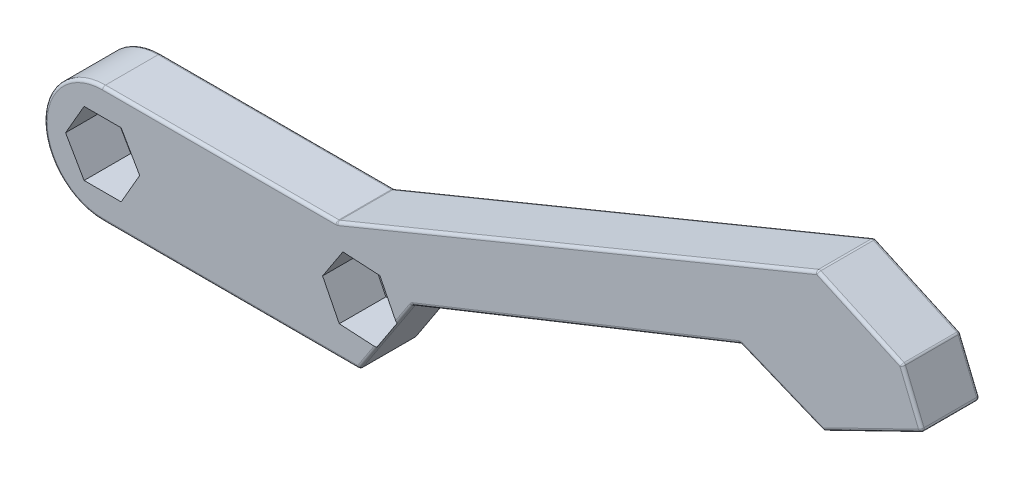
from build123d import *

# Parameters (mm, degrees)
SKETCH1_R           = 1.65
BOSS_EXTRUDE1_DEPTH = 5
FILLET2_R           = 0.25
CUT_EXTRUDE1_DEPTH  = 4


with BuildPart() as part:
    # Sketch1 → Boss-Extrude1 (new body)
    # profile 1 of 2: a face of its own
    with BuildSketch(Plane.XY):
        with BuildLine():
            Line((-5.168635154, -1.464478016), (-25.218635154, -1.464478016))
            ThreePointArc((-25.218635154, -1.464478016), (-30.218635154, -6.464478016), (-25.218635154, -11.464478016))
            Line((-25.218635154, -11.464478016), (-3.218635154, -11.464478016))
            Line((-3.218635154, -11.464478016), (1.36555506, -4.468181425))
            ThreePointArc((1.36555506, -4.468181425), (-0.47833252, -2.282284635), (-3.218635154, -1.464478016))
            Line((-3.218635154, -1.464478016), (-5.168635154, -1.464478016))
        make_face()
        with Locations((-25.218635154, -6.464478016)):
            Circle(SKETCH1_R, mode=Mode.SUBTRACT)
        with Locations((-3.197929879, -6.257635448)):
            Circle(SKETCH1_R, mode=Mode.SUBTRACT)
    # profile 2 of 2: a face of its own
    with BuildSketch(Plane.XY):
        with BuildLine():
            Line((35.988446, 15.45724385), (-5.168635154, -1.464478016))
            Line((-5.168635154, -1.464478016), (-3.218635154, -1.464478016))
            ThreePointArc((-3.218635154, -1.464478016), (-0.47833252, -2.282284635), (1.36555506, -4.468181425))
            Line((1.36555506, -4.468181425), (29.450627286, 6.742809526))
            Line((29.450627286, 6.742809526), (35.767904523, 4.15974363))
            Line((35.767904523, 4.15974363), (36.572261964, 3.843716482))
            Line((36.572261964, 3.843716482), (45.016686804, 7.962377757))
            Line((45.016686804, 7.962377757), (43.305501447, 12.124329784))
            Line((43.305501447, 12.124329784), (35.988446, 15.45724385))
        make_face()
    extrude(amount=BOSS_EXTRUDE1_DEPTH)

    # Fillet2
    fillet2_edges = [part.edges().sort_by_distance(p)[0] for p in [
        (-14.218635154, -11.464478016, 0),
        (-30.218635154, -6.464478016, 0),
        (-15.193635154, -1.464478016, 0),
        (15.409905423, 6.996382917, 0),
        (-0.926540047, -7.966329721, 5),
        (39.646973723, 13.790786817, 0),
        (44.161094126, 10.04335377, 0),
        (40.794474384, 5.90304712, 0),
        (36.170083243, 4.001730056, 0),
        (32.609265904, 5.451276578, 0),
        (15.408091173, 1.137314051, 0),
        (-0.926540047, -7.966329721, 0),
        (15.408091173, 1.137314051, 5),
        (-3.218635154, -11.464478016, 2.5),
        (-5.168635154, -1.464478016, 2.5),
        (35.988446, 15.45724385, 2.5),
        (43.305501447, 12.124329784, 2.5),
        (45.016686804, 7.962377757, 2.5),
        (36.572261964, 3.843716482, 2.5),
        (35.767904523, 4.15974363, 2.5),
        (29.450627286, 6.742809526, 2.5),
        (1.36555506, -4.468181425, 2.5),
        (32.609265904, 5.451276578, 5),
        (36.170083243, 4.001730056, 5),
        (40.794474384, 5.90304712, 5),
        (44.161094126, 10.04335377, 5),
        (39.646973723, 13.790786817, 5),
        (15.409905423, 6.996382917, 5),
        (-15.193635154, -1.464478016, 5),
        (-30.218635154, -6.464478016, 5),
        (-14.218635154, -11.464478016, 5),
    ]]
    fillet(fillet2_edges, radius=FILLET2_R)

    # Sketch2 → Cut-Extrude1 (cut)
    with BuildSketch(Plane.XY.offset(5)):
        Polygon((-23.630921913, -9.214478016), (-22.043208673, -6.464478016), (-23.630921913, -3.714478016), (-26.806348394, -3.714478016), (-28.394061634, -6.464478016), (-26.806348394, -9.214478016), align=None)
        Polygon((-0.027560565, -6.436777135), (-1.45760397, -3.601585926), (-4.627973284, -3.422444239), (-6.368299193, -6.078493761), (-4.938255788, -8.91368497), (-1.767886474, -9.092826657), align=None)
    extrude(amount=-CUT_EXTRUDE1_DEPTH, mode=Mode.SUBTRACT)


solid = part.part
